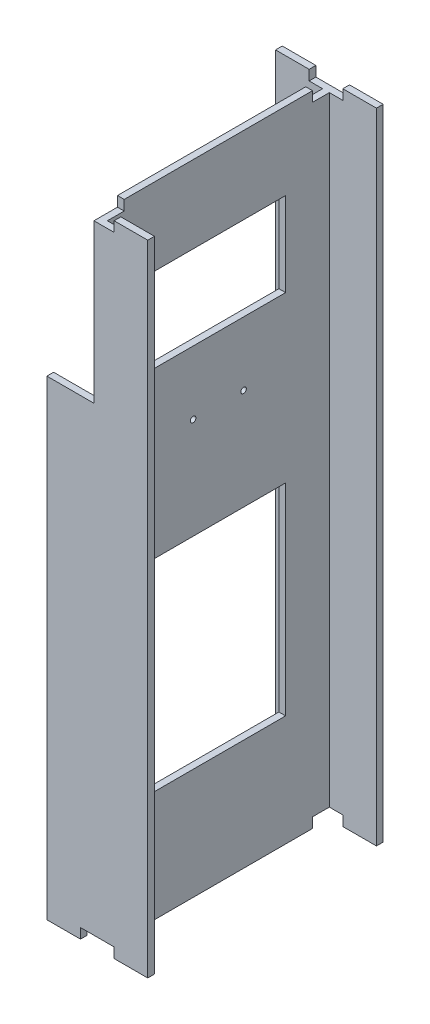
from build123d import *

# Parameters (mm, degrees)
BOSS_EXTRUDE1_DEPTH = 95
SKETCH3_W           = 10
SKETCH3_H           = 10
CUT_EXTRUDE2_DEPTH  = 3
SKETCH4_W           = 40
SKETCH4_H           = 25
SKETCH4_H_2         = 60
CUT_EXTRUDE8_DEPTH  = 2
SKETCH5_W           = 14
SKETCH5_H           = 50
CUT_EXTRUDE9_DEPTH  = 2
SKETCH6_R           = 0.825
CUT_EXTRUDE10_DEPTH = 203.435174809


with BuildPart() as part:
    # Sketch1 → Boss-Extrude1 (new body)
    with BuildSketch(Plane(origin=(0, 0, 0), x_dir=(1, 0, 0), z_dir=(0, 1, 0))):
        Polygon((0, 0), (0, 66), (14, 66), (14, 68), (-16, 68), (-16, 66), (-2, 66), (-2, 0), (-16, 0), (-16, -2), (14, -2), (14, 0), align=None)
    extrude(amount=BOSS_EXTRUDE1_DEPTH)

    # Sketch3 → Cut-Extrude2 (cut)
    with BuildSketch(Plane.XZ):
        with Locations((-1, 0)):
            Rectangle(SKETCH3_W, SKETCH3_H)
        with Locations((-1, -66)):
            Rectangle(SKETCH3_W, SKETCH3_H)
    extrude(amount=-CUT_EXTRUDE2_DEPTH, mode=Mode.SUBTRACT)

    # Mirror2: part across plane


with BuildPart() as part_1:
    add(part.part)
    add(part.part.mirror(Plane(origin=(0, 95, 0), x_dir=(0, 0, 1), z_dir=(0, -1, 0))))

    # Sketch4 → Cut-Extrude8 (cut)
    with BuildSketch(Plane.ZY.offset(2)):
        with Locations((-33, 154.5)):
            Rectangle(SKETCH4_W, SKETCH4_H)
        with Locations((-33, 63)):
            Rectangle(SKETCH4_W, SKETCH4_H_2)
    extrude(amount=-CUT_EXTRUDE8_DEPTH, mode=Mode.SUBTRACT)

    # Sketch5 → Cut-Extrude9 (cut)
    with BuildSketch(Plane(origin=(0, 0, 0), x_dir=(-1, 0, 0), z_dir=(0, 0, -1))):
        with Locations((9, 165)):
            Rectangle(SKETCH5_W, SKETCH5_H)
    extrude(amount=-CUT_EXTRUDE9_DEPTH, mode=Mode.SUBTRACT)

    # Sketch6 → Cut-Extrude10 (cut, through all)
    with BuildSketch(Plane(origin=(0, 0, 0), x_dir=(0, 0, -1), z_dir=(1, 0, 0))):
        with Locations((40.5, 123.074804834)):
            Circle(SKETCH6_R)
        with Locations((25.5, 123.074804834)):
            Circle(SKETCH6_R)
    extrude(amount=-CUT_EXTRUDE10_DEPTH, mode=Mode.SUBTRACT)


solid = part_1.part
